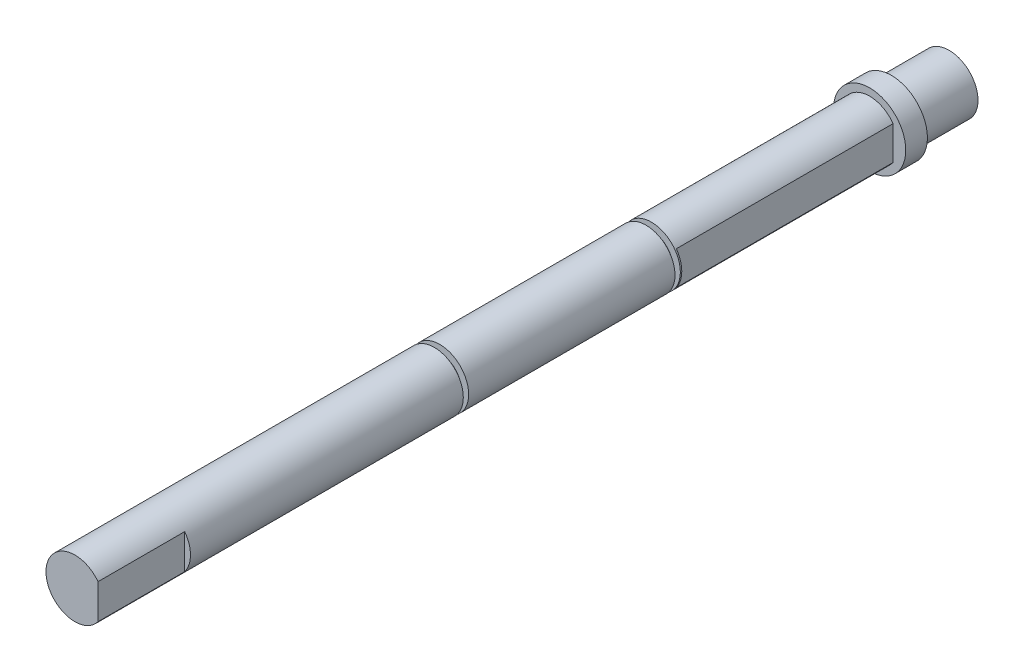
from build123d import *

# Parameters (mm, degrees)
SKETCH1_R           = 4
LOWER_SEAT_DEPTH    = 8
SKETCH2_R           = 5
COLLAR_DEPTH        = 3
SKETCH3_R           = 4
UPPER_DEPTH         = 110
SKETCH4_R           = 5
SKETCH4_R_2         = 3
ECLIP_GROOVE1_DEPTH = 0.74
SKETCH5_R           = 5
SKETCH5_R_2         = 3
ECLIP_GROOVE2_DEPTH = 0.74
SKETCH6_W           = 3
SKETCH6_H           = 10
BURR_FLATS_DEPTH    = 30
SKETCH7_W           = 3
SKETCH7_H           = 10
CRANK_FLAT_DEPTH    = 12


with BuildPart() as part:
    # Sketch1 → Lower_seat (new body)
    with BuildSketch(Plane.XY):
        Circle(SKETCH1_R)
    extrude(amount=LOWER_SEAT_DEPTH)

    # Sketch2 → Collar (add)
    with BuildSketch(Plane.XY.offset(8)):
        Circle(SKETCH2_R)
    extrude(amount=COLLAR_DEPTH)

    # Sketch3 → Upper (add)
    with BuildSketch(Plane.XY.offset(11)):
        Circle(SKETCH3_R)
    extrude(amount=UPPER_DEPTH)

    # Sketch4 → Eclip_groove1 (cut)
    with BuildSketch(Plane.XY.offset(41.2)):
        Circle(SKETCH4_R)
        Circle(SKETCH4_R_2, mode=Mode.SUBTRACT)
    extrude(amount=ECLIP_GROOVE1_DEPTH, mode=Mode.SUBTRACT)

    # Sketch5 → Eclip_groove2 (cut)
    with BuildSketch(Plane.XY.offset(70.5)):
        Circle(SKETCH5_R)
        Circle(SKETCH5_R_2, mode=Mode.SUBTRACT)
    extrude(amount=ECLIP_GROOVE2_DEPTH, mode=Mode.SUBTRACT)

    # Sketch6 → Burr_flats (cut)
    with BuildSketch(Plane.XY.offset(11)):
        with Locations((4.75, 0)):
            Rectangle(SKETCH6_W, SKETCH6_H)
        with Locations((-4.75, 0)):
            Rectangle(SKETCH6_W, SKETCH6_H)
    extrude(amount=BURR_FLATS_DEPTH, mode=Mode.SUBTRACT)

    # Sketch7 → Crank_flat (cut)
    with BuildSketch(Plane.XY.offset(109)):
        with Locations((4.7, 0)):
            Rectangle(SKETCH7_W, SKETCH7_H)
    extrude(amount=CRANK_FLAT_DEPTH, mode=Mode.SUBTRACT)


solid = part.part
